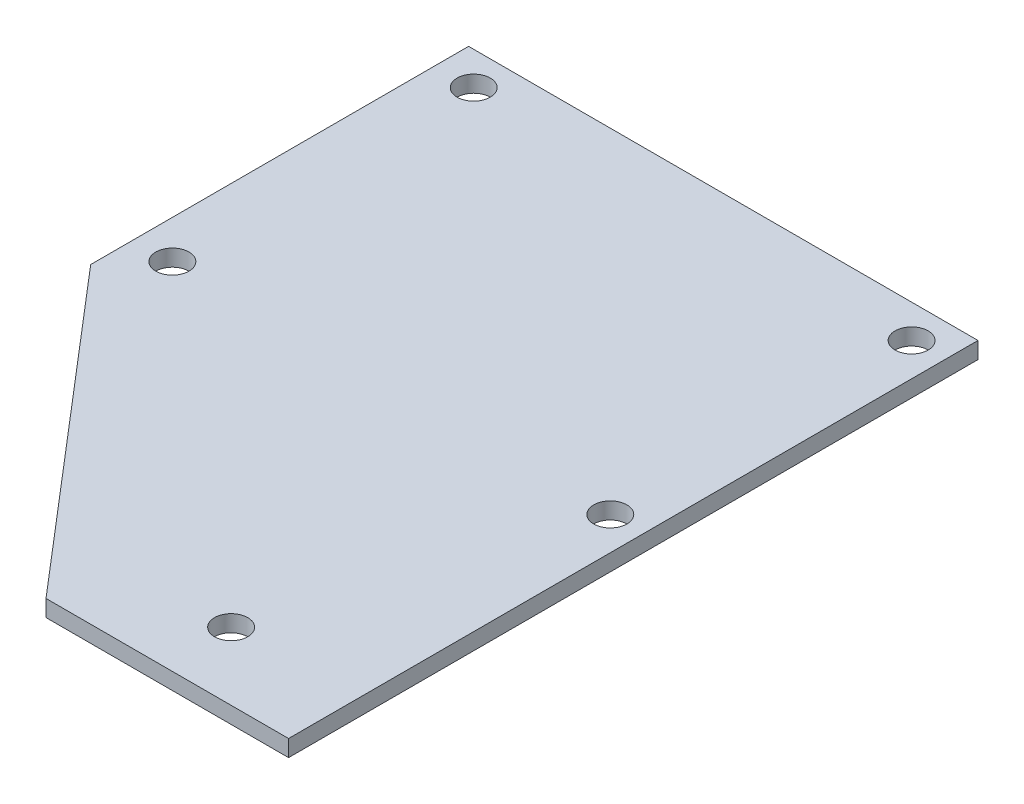
from build123d import *

# Parameters (mm, degrees)
BOSS_EXTRUDE1_DEPTH = 3.302
SKETCH2_R           = 3.302
CUT_EXTRUDE1_DEPTH  = 23.368


with BuildPart() as part:
    # Sketch1 → Boss-Extrude1 (new body)
    with BuildSketch(Plane(origin=(0, 0, 0), x_dir=(1, 0, 0), z_dir=(0, 1, 0))):
        Polygon((0, 0), (-48.26, 0), (-101.346, 61.976), (-101.346, 137.16), (0, 137.16), align=None)
    extrude(amount=BOSS_EXTRUDE1_DEPTH)

    # Sketch2 → Cut-Extrude1 (cut)
    with BuildSketch(Plane(origin=(0, 3.302, 0), x_dir=(1, 0, 0), z_dir=(0, 1, 0))):
        with Locations(Location((-93.726, 70.612, 0), (0, 0, 270))):
            Circle(SKETCH2_R)
        with Locations(Location((-24.892, 13.462, 0), (0, 0, 270))):
            Circle(SKETCH2_R)
        with Locations(Location((-6.604, 70.612, 0), (0, 0, 270))):
            Circle(SKETCH2_R)
        with Locations(Location((-6.604, 130.556, 0), (0, 0, 270))):
            Circle(SKETCH2_R)
        with Locations(Location((-93.726, 130.556, 0), (0, 0, 270))):
            Circle(SKETCH2_R)
    extrude(amount=-CUT_EXTRUDE1_DEPTH, mode=Mode.SUBTRACT)


solid = part.part
